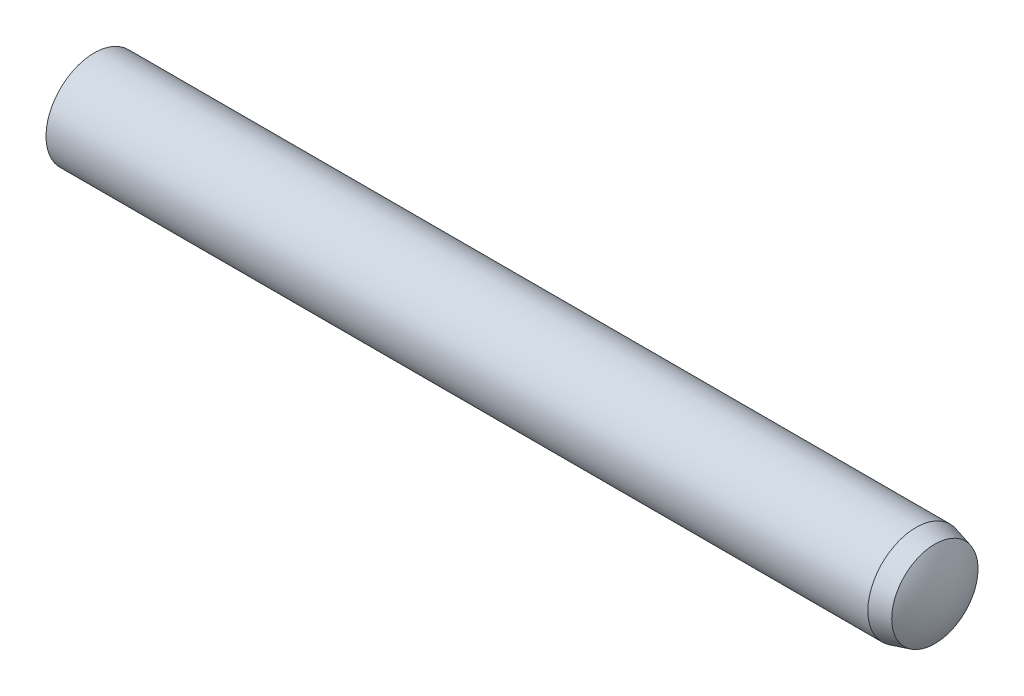
from build123d import *

# Parameters (mm, degrees)
EXTRUDE1_DEPTH      = 9
EXTRUDE1_DEPTH_BACK = 9
SKETCH2_R           = 1


with BuildPart() as part:
    # Sketch2 → Extrude1 (new, two sides: drawn at the far end of the back side and taken through both)
    with BuildSketch(Plane(origin=(0, 0, 0), x_dir=(0, 0, -1), z_dir=(1, 0, 0)).offset(-EXTRUDE1_DEPTH_BACK)):
        Circle(SKETCH2_R)
    extrude(amount=EXTRUDE1_DEPTH + EXTRUDE1_DEPTH_BACK)

    # Sketch5 → Cut-Revolve1 (revolve, cut)
    with BuildSketch(Plane.XY, mode=Mode.PRIVATE) as cut_revolve1_sk:
        with BuildLine():
            Line((8.35, 1), (8.35, 1.5))
            Line((8.35, 1.5), (9.5, 1.5))
            Line((9.5, 1.5), (9.5, 0))
            Line((9.5, 0), (9, 0))
            ThreePointArc((9, 0), (8.933685026, 0.46624026), (8.74, 0.895499815))
            Line((8.74, 0.895499815), (8.35, 1))
        make_face()
        with BuildLine():
            Line((-8.7, 1), (-8.7, 1.5))
            Line((-8.7, 1.5), (-9.5, 1.5))
            Line((-9.5, 1.5), (-9.5, 0))
            Line((-9.5, 0), (-9, 0))
            ThreePointArc((-9, 0), (-8.923384418, 0.522015325), (-8.7, 1))
        make_face()
    revolve(cut_revolve1_sk.sketch.rotate(Axis((-9, 0, 0), (1, 0, 0)), 90), axis=Axis((-9, 0, 0), (1, 0, 0)), mode=Mode.SUBTRACT)


solid = part.part
